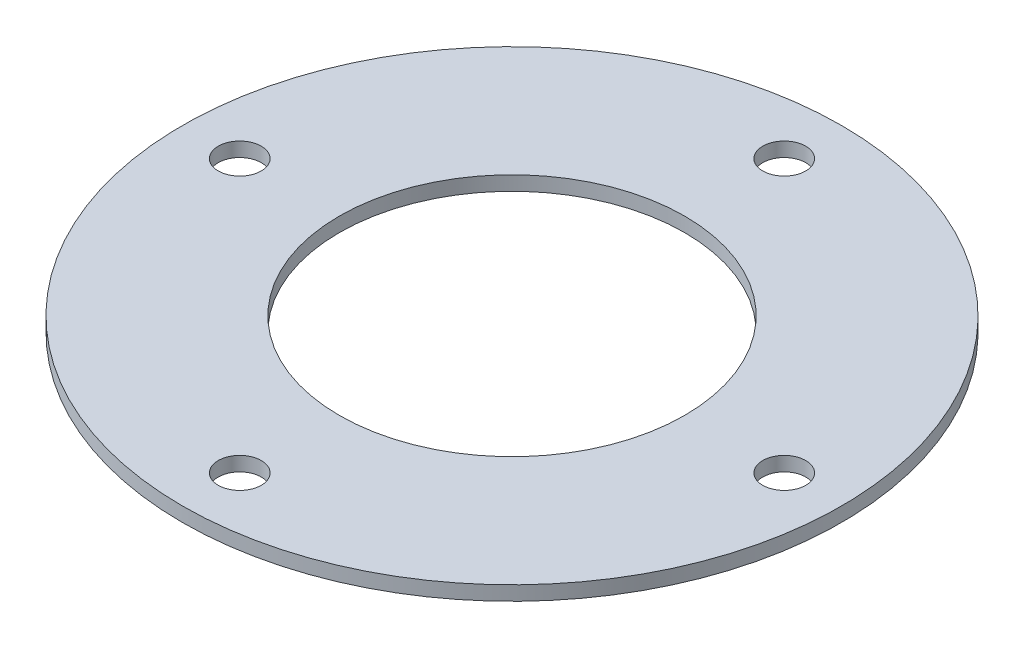
from build123d import *

# Parameters (mm, degrees)
SKETCH1_R           = 23
SKETCH1_R_2         = 12.05
SKETCH1_R_3         = 1.5
BOSS_EXTRUDE1_DEPTH = 1


with BuildPart() as part:
    # Sketch1 → Boss-Extrude1 (new body)
    with BuildSketch(Plane(origin=(0, 0, 0), x_dir=(1, 0, 0), z_dir=(0, 1, 0))):
        with Locations(Location((0, 0, 0), (0, 0, 270))):
            Circle(SKETCH1_R)
        with Locations(Location((0, 0, 0), (0, 0, 270))):
            Circle(SKETCH1_R_2, mode=Mode.SUBTRACT)
        with Locations(Location((0, 19, 0), (0, 0, 270))):
            Circle(SKETCH1_R_3, mode=Mode.SUBTRACT)
        with Locations(Location((19, 0, 0), (0, 0, 270))):
            Circle(SKETCH1_R_3, mode=Mode.SUBTRACT)
        with Locations(Location((0, -19, 0), (0, 0, 270))):
            Circle(SKETCH1_R_3, mode=Mode.SUBTRACT)
        with Locations(Location((-19, 0, 0), (0, 0, 270))):
            Circle(SKETCH1_R_3, mode=Mode.SUBTRACT)
    extrude(amount=BOSS_EXTRUDE1_DEPTH)


solid = part.part
